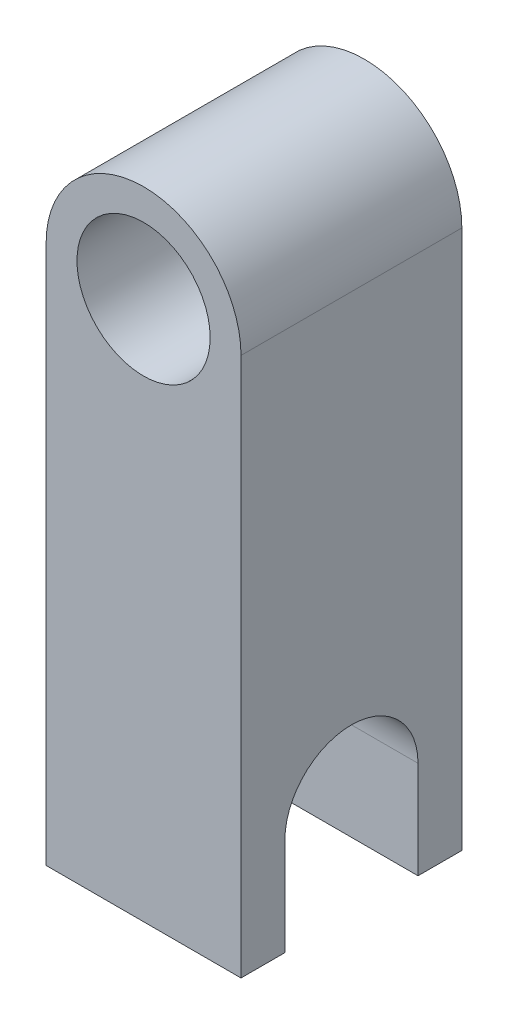
from build123d import *

# Parameters (mm, degrees)
BOSS_EXTRUDE1_DEPTH = 34
SKETCH2_W           = 34
SKETCH2_H           = 15
BOSS_EXTRUDE2_DEPTH = 30
SKETCH3_R           = 10.25
CUT_EXTRUDE1_DEPTH  = 30
SKETCH4_W           = 20.5
SKETCH4_H           = 15
CUT_EXTRUDE2_DEPTH  = 34


with BuildPart() as part:
    # Sketch1 → Boss-Extrude1 (new body)
    # profile 1 of 3: a face of its own
    with BuildSketch(Plane.XY):
        with BuildLine():
            Line((-15, 0), (-15, -68))
            ThreePointArc((-15, -68), (0, -83), (15, -68))
            Line((15, -68), (15, 0))
            ThreePointArc((15, 0), (0, 15), (-15, 0))
        make_face()
        with BuildLine():
            ThreePointArc((-10.25, -68), (0, -78.25), (10.25, -68))
            Line((10.25, -68), (10.25, 0))
            ThreePointArc((10.25, 0), (0, 10.25), (-10.25, 0))
            Line((-10.25, 0), (-10.25, -68))
        make_face(mode=Mode.SUBTRACT)
    # profile 2 of 3: a face of its own
    with BuildSketch(Plane.XY):
        with BuildLine():
            Line((10.25, -68), (10.25, 0))
            ThreePointArc((10.25, 0), (0, -10.25), (-10.25, 0))
            Line((-10.25, 0), (-10.25, -68))
            ThreePointArc((-10.25, -68), (0, -57.75), (10.25, -68))
        make_face()
    # profile 3 of 3: a face of its own
    with BuildSketch(Plane.XY):
        with BuildLine():
            ThreePointArc((-10.25, -68), (0, -78.25), (10.25, -68))
            ThreePointArc((10.25, -68), (0, -57.75), (-10.25, -68))
        make_face()
    extrude(amount=BOSS_EXTRUDE1_DEPTH)

    # Sketch2 → Boss-Extrude2 (add)
    with BuildSketch(Plane.ZY.offset(15)):
        with Locations((17, -75.5)):
            Rectangle(SKETCH2_W, SKETCH2_H)
    extrude(amount=-BOSS_EXTRUDE2_DEPTH)

    # Sketch3 → Cut-Extrude1 (cut)
    with BuildSketch(Plane.ZY.offset(15)):
        with Locations(Location((17, -68, 0), (0, 0, 270))):
            Circle(SKETCH3_R)
    extrude(amount=-CUT_EXTRUDE1_DEPTH, mode=Mode.SUBTRACT)

    # Sketch4 → Cut-Extrude2 (cut)
    with BuildSketch(Plane.ZY.offset(15)):
        with Locations((17, -75.5)):
            Rectangle(SKETCH4_W, SKETCH4_H)
    extrude(amount=-CUT_EXTRUDE2_DEPTH, mode=Mode.SUBTRACT)


solid = part.part
